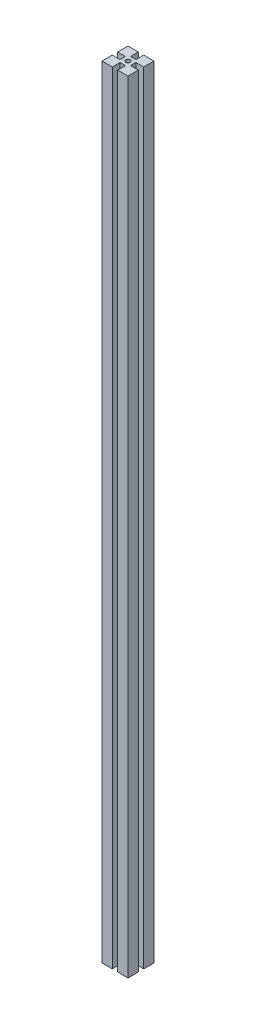
from build123d import *

# Parameters (mm, degrees)
AUFSATZ_LINEAR_AUSTRAGEN1_DEPTH = 1200
SKIZZE2_R                       = 3.45
SCHNITT_LINEAR_AUSTRAGEN1_DEPTH = 30


with BuildPart() as part:
    # Skizze1 → Aufsatz-Linear austragen1 (new body)
    with BuildSketch(Plane(origin=(0, 0, 0), x_dir=(1, 0, 0), z_dir=(0, 1, 0))):
        Polygon((-4.1, -20), (-4.1, -8), (4.1, -8), (4.1, -20), (20, -20), (20, -4.1), (8, -4.1), (8, 4.1), (20, 4.1), (20, 20), (4.1, 20), (4.1, 8), (-4.1, 8), (-4.1, 20), (-20, 20), (-20, 4.1), (-8, 4.1), (-8, -4.1), (-20, -4.1), (-20, -20), align=None)
    extrude(amount=AUFSATZ_LINEAR_AUSTRAGEN1_DEPTH)

    # Skizze2 → Schnitt-Linear austragen1 (cut)
    with BuildSketch(Plane(origin=(0, 1200, 0), x_dir=(1, 0, 0), z_dir=(0, 1, 0))):
        with Locations(Location((0, 0, 0), (0, 0, 270))):
            Circle(SKIZZE2_R)
    extrude(amount=-SCHNITT_LINEAR_AUSTRAGEN1_DEPTH, mode=Mode.SUBTRACT)


solid = part.part
